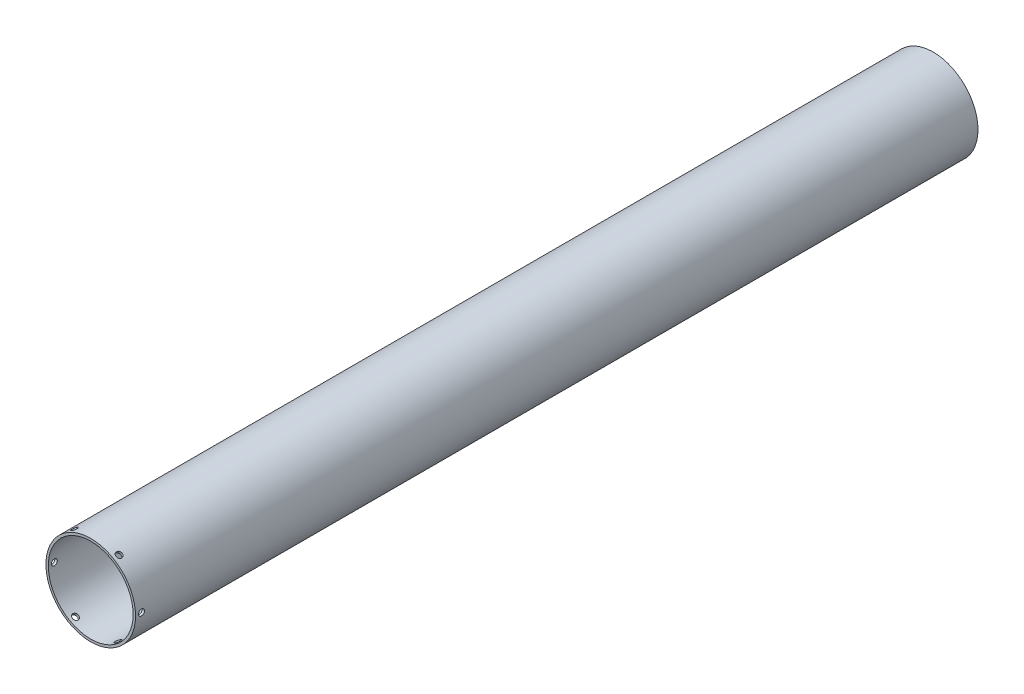
from build123d import *

# Parameters (mm, degrees)
SKETCH1_R               = 37.5
SKETCH1_R_2             = 35.5
BOSS_EXTRUDE1_DEPTH     = 352.5
CUT_EXTRUDE1_REACH      = 364.336
CUT_EXTRUDE1_END_RADIUS = 35.5
SKETCH2_R               = 2.5
CIRPATTERN1_COUNT       = 6


with BuildPart() as part:
    # Sketch1 → Boss-Extrude1 (new, symmetric)
    with BuildSketch(Plane.XY):
        Circle(SKETCH1_R)
        Circle(SKETCH1_R_2, mode=Mode.SUBTRACT)
    extrude(amount=BOSS_EXTRUDE1_DEPTH, both=True)

    # Cut-Extrude1: up to this cylinder (the profile starts outside it)
    cut_extrude1_end = Plane(origin=(0, 0, 347.5), z_dir=(0, 0, -1)) * Cylinder(CUT_EXTRUDE1_END_RADIUS, 800.672, mode=Mode.PRIVATE)
    # Sketch2 → Cut-Extrude1 (cut, up to the surface)
    with BuildSketch(Plane(origin=(37.5, 0, 0), x_dir=(0, 0, -1), z_dir=(1, 0, 0)), mode=Mode.PRIVATE) as cut_extrude1_sk1:
        with Locations((-347.5, 0)):
            Circle(SKETCH2_R)
    cut_extrude1_tool1 = extrude(cut_extrude1_sk1.sketch, amount=-CUT_EXTRUDE1_REACH, mode=Mode.PRIVATE) - cut_extrude1_end
    cut_extrude1 = cut_extrude1_tool1.solids().sort_by_distance((37.5, 0, 347.5))[0]
    add(cut_extrude1, mode=Mode.SUBTRACT)

    # CirPattern1: Cut-Extrude1 ×6 about axis
    cirpattern1_axis = Axis((0, 0, 352.5), (0, 0, 1))
    for i in range(1, CIRPATTERN1_COUNT):
        add(cut_extrude1.rotate(cirpattern1_axis, i * 360 / CIRPATTERN1_COUNT), mode=Mode.SUBTRACT)


solid = part.part
